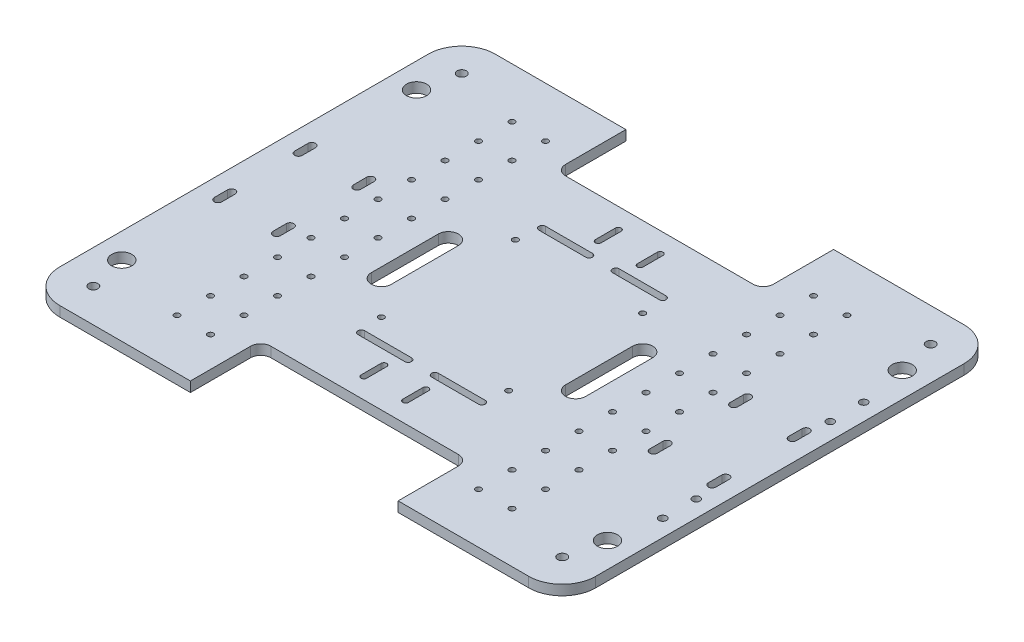
from build123d import *

# Parameters (mm, degrees)
PLATE_DEPTH                       = 6
CUT_MOTORMOUNTS_M3_DEPTH          = 207.242575624
CUT_MOTORMOUNTS_M3_DEPTH_BACK     = 207.242575624
CUT_CASTERMOUNTS_M4_DEPTH         = 207.242575624
CUT_CASTERMOUNTS_M4_DEPTH_BACK    = 207.242575624
CUT_BATTERYBAY_DEPTH              = 207.242575624
CUT_BATTERYBAY_DEPTH_BACK         = 207.242575624
SK_BATTERYBAY_R                   = 1.7
CUT_CABLEPASSTHRU_DEPTH           = 207.242575624
CUT_CABLEPASSTHRU_DEPTH_BACK      = 207.242575624
CUT_ELECGRID_M3_DEPTH             = 207.242575624
CUT_ELECGRID_M3_DEPTH_BACK        = 207.242575624
SK_ELECGRID_M3_R                  = 1.7
CUT_DECKPOSTS_M5_DEPTH            = 207.242575624
CUT_DECKPOSTS_M5_DEPTH_BACK       = 207.242575624
SK_DECKPOSTS_M5_R                 = 2.75
CUT_CLIFFSENSORWINDOWS_DEPTH      = 207.242575624
CUT_CLIFFSENSORWINDOWS_DEPTH_BACK = 207.242575624
SK_CLIFFSENSORS_R                 = 6
CUT_CHARGECONTACTS_M4_DEPTH       = 207.242575624
CUT_CHARGECONTACTS_M4_DEPTH_BACK  = 207.242575624
SK_CHARGECONTACTS_R               = 2.25


with BuildPart() as part:
    # SK_Plate → Plate (new body)
    with BuildSketch(Plane(origin=(0, 0, 0), x_dir=(1, 0, 0), z_dir=(0, 1, 0))):
        with BuildLine():
            Line((160, -110), (160, 110))
            ThreePointArc((160, 110), (154.142135624, 124.142135624), (140, 130))
            Line((140, 130), (62, 130))
            Line((62, 130), (62, 94))
            ThreePointArc((62, 94), (60.242640687, 89.757359313), (56, 88))
            Line((56, 88), (-56, 88))
            ThreePointArc((-56, 88), (-60.242640687, 89.757359313), (-62, 94))
            Line((-62, 94), (-62, 130))
            Line((-62, 130), (-140, 130))
            ThreePointArc((-140, 130), (-154.142135624, 124.142135624), (-160, 110))
            Line((-160, 110), (-160, -110))
            ThreePointArc((-160, -110), (-154.142135624, -124.142135624), (-140, -130))
            Line((-140, -130), (-62, -130))
            Line((-62, -130), (-62, -94))
            ThreePointArc((-62, -94), (-60.242640687, -89.757359313), (-56, -88))
            Line((-56, -88), (56, -88))
            ThreePointArc((56, -88), (60.242640687, -89.757359313), (62, -94))
            Line((62, -94), (62, -130))
            Line((62, -130), (140, -130))
            ThreePointArc((140, -130), (154.142135624, -124.142135624), (160, -110))
        make_face()
    extrude(amount=PLATE_DEPTH)

    # SK_MotorMounts → Cut_MotorMounts_M3 (cut, two sides: drawn at the far end of the back side and taken through both)
    with BuildSketch(Plane(origin=(0, 0, 0), x_dir=(1, 0, 0), z_dir=(0, 1, 0)).offset(-CUT_MOTORMOUNTS_M3_DEPTH_BACK)):
        with BuildLine():
            Line((-14.2, 64), (-14.2, 76))
            ThreePointArc((-14.2, 76), (-12.5, 77.7), (-10.8, 76))
            Line((-10.8, 76), (-10.8, 64))
            ThreePointArc((-10.8, 64), (-12.5, 62.3), (-14.2, 64))
        make_face()
        with BuildLine():
            Line((10.8, 64), (10.8, 76))
            ThreePointArc((10.8, 76), (12.5, 77.7), (14.2, 76))
            Line((14.2, 76), (14.2, 64))
            ThreePointArc((14.2, 64), (12.5, 62.3), (10.8, 64))
        make_face()
        with BuildLine():
            Line((-10.8, -64), (-10.8, -76))
            ThreePointArc((-10.8, -76), (-12.5, -77.7), (-14.2, -76))
            Line((-14.2, -76), (-14.2, -64))
            ThreePointArc((-14.2, -64), (-12.5, -62.3), (-10.8, -64))
        make_face()
        with BuildLine():
            Line((14.2, -64), (14.2, -76))
            ThreePointArc((14.2, -76), (12.5, -77.7), (10.8, -76))
            Line((10.8, -76), (10.8, -64))
            ThreePointArc((10.8, -64), (12.5, -62.3), (14.2, -64))
        make_face()
    extrude(amount=CUT_MOTORMOUNTS_M3_DEPTH + CUT_MOTORMOUNTS_M3_DEPTH_BACK, mode=Mode.SUBTRACT)

    # SK_CasterMounts → Cut_CasterMounts_M4 (cut, two sides: drawn at the far end of the back side and taken through both)
    with BuildSketch(Plane(origin=(0, 0, 0), x_dir=(1, 0, 0), z_dir=(0, 1, 0)).offset(-CUT_CASTERMOUNTS_M4_DEPTH_BACK)):
        with BuildLine():
            Line((110.25, 20), (110.25, 28))
            ThreePointArc((110.25, 28), (112.5, 30.25), (114.75, 28))
            Line((114.75, 28), (114.75, 20))
            ThreePointArc((114.75, 20), (112.5, 17.75), (110.25, 20))
        make_face()
        with BuildLine():
            Line((114.75, -20), (114.75, -28))
            ThreePointArc((114.75, -28), (112.5, -30.25), (110.25, -28))
            Line((110.25, -28), (110.25, -20))
            ThreePointArc((110.25, -20), (112.5, -17.75), (114.75, -20))
        make_face()
        with BuildLine():
            Line((145.25, 20), (145.25, 28))
            ThreePointArc((145.25, 28), (147.5, 30.25), (149.75, 28))
            Line((149.75, 28), (149.75, 20))
            ThreePointArc((149.75, 20), (147.5, 17.75), (145.25, 20))
        make_face()
        with BuildLine():
            Line((149.75, -20), (149.75, -28))
            ThreePointArc((149.75, -28), (147.5, -30.25), (145.25, -28))
            Line((145.25, -28), (145.25, -20))
            ThreePointArc((145.25, -20), (147.5, -17.75), (149.75, -20))
        make_face()
        with BuildLine():
            Line((-149.75, 20), (-149.75, 28))
            ThreePointArc((-149.75, 28), (-147.5, 30.25), (-145.25, 28))
            Line((-145.25, 28), (-145.25, 20))
            ThreePointArc((-145.25, 20), (-147.5, 17.75), (-149.75, 20))
        make_face()
        with BuildLine():
            Line((-145.25, -20), (-145.25, -28))
            ThreePointArc((-145.25, -28), (-147.5, -30.25), (-149.75, -28))
            Line((-149.75, -28), (-149.75, -20))
            ThreePointArc((-149.75, -20), (-147.5, -17.75), (-145.25, -20))
        make_face()
        with BuildLine():
            Line((-114.75, 20), (-114.75, 28))
            ThreePointArc((-114.75, 28), (-112.5, 30.25), (-110.25, 28))
            Line((-110.25, 28), (-110.25, 20))
            ThreePointArc((-110.25, 20), (-112.5, 17.75), (-114.75, 20))
        make_face()
        with BuildLine():
            Line((-110.25, -20), (-110.25, -28))
            ThreePointArc((-110.25, -28), (-112.5, -30.25), (-114.75, -28))
            Line((-114.75, -28), (-114.75, -20))
            ThreePointArc((-114.75, -20), (-112.5, -17.75), (-110.25, -20))
        make_face()
    extrude(amount=CUT_CASTERMOUNTS_M4_DEPTH + CUT_CASTERMOUNTS_M4_DEPTH_BACK, mode=Mode.SUBTRACT)

    # SK_BatteryBay → Cut_BatteryBay (cut, two sides: drawn at the far end of the back side and taken through both)
    with BuildSketch(Plane(origin=(0, 0, 0), x_dir=(1, 0, 0), z_dir=(0, 1, 0)).offset(-CUT_BATTERYBAY_DEPTH_BACK)):
        with Locations(Location((-38, 40, 0), (0, 0, 270))):
            Circle(SK_BATTERYBAY_R)
        with Locations(Location((-38, -40, 0), (0, 0, 270))):
            Circle(SK_BATTERYBAY_R)
        with Locations(Location((38, 40, 0), (0, 0, 270))):
            Circle(SK_BATTERYBAY_R)
        with Locations(Location((38, -40, 0), (0, 0, 270))):
            Circle(SK_BATTERYBAY_R)
        with BuildLine():
            Line((-36, 56), (-8, 56))
            ThreePointArc((-8, 56), (-6, 54), (-8, 52))
            Line((-8, 52), (-36, 52))
            ThreePointArc((-36, 52), (-38, 54), (-36, 56))
        make_face()
        with BuildLine():
            Line((-36, -52), (-8, -52))
            ThreePointArc((-8, -52), (-6, -54), (-8, -56))
            Line((-8, -56), (-36, -56))
            ThreePointArc((-36, -56), (-38, -54), (-36, -52))
        make_face()
        with BuildLine():
            Line((8, 56), (36, 56))
            ThreePointArc((36, 56), (38, 54), (36, 52))
            Line((36, 52), (8, 52))
            ThreePointArc((8, 52), (6, 54), (8, 56))
        make_face()
        with BuildLine():
            Line((8, -52), (36, -52))
            ThreePointArc((36, -52), (38, -54), (36, -56))
            Line((36, -56), (8, -56))
            ThreePointArc((8, -56), (6, -54), (8, -52))
        make_face()
    extrude(amount=CUT_BATTERYBAY_DEPTH + CUT_BATTERYBAY_DEPTH_BACK, mode=Mode.SUBTRACT)

    # SK_CablePassThru → Cut_CablePassThru (cut, two sides: drawn at the far end of the back side and taken through both)
    with BuildSketch(Plane(origin=(0, 0, 0), x_dir=(1, 0, 0), z_dir=(0, 1, 0)).offset(-CUT_CABLEPASSTHRU_DEPTH_BACK)):
        with BuildLine():
            Line((52, -20), (52, 20))
            ThreePointArc((52, 20), (58, 26), (64, 20))
            Line((64, 20), (64, -20))
            ThreePointArc((64, -20), (58, -26), (52, -20))
        make_face()
        with BuildLine():
            Line((-64, -20), (-64, 20))
            ThreePointArc((-64, 20), (-58, 26), (-52, 20))
            Line((-52, 20), (-52, -20))
            ThreePointArc((-52, -20), (-58, -26), (-64, -20))
        make_face()
    extrude(amount=CUT_CABLEPASSTHRU_DEPTH + CUT_CABLEPASSTHRU_DEPTH_BACK, mode=Mode.SUBTRACT)

    # SK_ElecGrid_M3 → Cut_ElecGrid_M3 (cut, two sides: drawn at the far end of the back side and taken through both)
    with BuildSketch(Plane(origin=(0, 0, 0), x_dir=(1, 0, 0), z_dir=(0, 1, 0)).offset(-CUT_ELECGRID_M3_DEPTH_BACK)):
        with Locations(Location((-100, -100, 0), (0, 0, 270))):
            Circle(SK_ELECGRID_M3_R)
        with Locations(Location((-100, -80, 0), (0, 0, 270))):
            Circle(SK_ELECGRID_M3_R)
        with Locations(Location((-100, -60, 0), (0, 0, 270))):
            Circle(SK_ELECGRID_M3_R)
        with Locations(Location((-100, -40, 0), (0, 0, 270))):
            Circle(SK_ELECGRID_M3_R)
        with Locations(Location((-100, -20, 0), (0, 0, 270))):
            Circle(SK_ELECGRID_M3_R)
        with Locations(Location((-100, 0, 0), (0, 0, 270))):
            Circle(SK_ELECGRID_M3_R)
        with Locations(Location((-100, 20, 0), (0, 0, 270))):
            Circle(SK_ELECGRID_M3_R)
        with Locations(Location((-100, 40, 0), (0, 0, 270))):
            Circle(SK_ELECGRID_M3_R)
        with Locations(Location((-100, 60, 0), (0, 0, 270))):
            Circle(SK_ELECGRID_M3_R)
        with Locations(Location((-100, 80, 0), (0, 0, 270))):
            Circle(SK_ELECGRID_M3_R)
        with Locations(Location((-100, 100, 0), (0, 0, 270))):
            Circle(SK_ELECGRID_M3_R)
        with Locations(Location((-80, -100, 0), (0, 0, 270))):
            Circle(SK_ELECGRID_M3_R)
        with Locations(Location((-80, -80, 0), (0, 0, 270))):
            Circle(SK_ELECGRID_M3_R)
        with Locations(Location((-80, -60, 0), (0, 0, 270))):
            Circle(SK_ELECGRID_M3_R)
        with Locations(Location((-80, -40, 0), (0, 0, 270))):
            Circle(SK_ELECGRID_M3_R)
        with Locations(Location((-80, -20, 0), (0, 0, 270))):
            Circle(SK_ELECGRID_M3_R)
        with Locations(Location((-80, 0, 0), (0, 0, 270))):
            Circle(SK_ELECGRID_M3_R)
        with Locations(Location((-80, 20, 0), (0, 0, 270))):
            Circle(SK_ELECGRID_M3_R)
        with Locations(Location((-80, 40, 0), (0, 0, 270))):
            Circle(SK_ELECGRID_M3_R)
        with Locations(Location((-80, 60, 0), (0, 0, 270))):
            Circle(SK_ELECGRID_M3_R)
        with Locations(Location((-80, 80, 0), (0, 0, 270))):
            Circle(SK_ELECGRID_M3_R)
        with Locations(Location((-80, 100, 0), (0, 0, 270))):
            Circle(SK_ELECGRID_M3_R)
        with Locations(Location((80, -100, 0), (0, 0, 270))):
            Circle(SK_ELECGRID_M3_R)
        with Locations(Location((80, -80, 0), (0, 0, 270))):
            Circle(SK_ELECGRID_M3_R)
        with Locations(Location((80, -60, 0), (0, 0, 270))):
            Circle(SK_ELECGRID_M3_R)
        with Locations(Location((80, -40, 0), (0, 0, 270))):
            Circle(SK_ELECGRID_M3_R)
        with Locations(Location((80, -20, 0), (0, 0, 270))):
            Circle(SK_ELECGRID_M3_R)
        with Locations(Location((80, 0, 0), (0, 0, 270))):
            Circle(SK_ELECGRID_M3_R)
        with Locations(Location((80, 20, 0), (0, 0, 270))):
            Circle(SK_ELECGRID_M3_R)
        with Locations(Location((80, 40, 0), (0, 0, 270))):
            Circle(SK_ELECGRID_M3_R)
        with Locations(Location((80, 60, 0), (0, 0, 270))):
            Circle(SK_ELECGRID_M3_R)
        with Locations(Location((80, 80, 0), (0, 0, 270))):
            Circle(SK_ELECGRID_M3_R)
        with Locations(Location((80, 100, 0), (0, 0, 270))):
            Circle(SK_ELECGRID_M3_R)
        with Locations(Location((100, -100, 0), (0, 0, 270))):
            Circle(SK_ELECGRID_M3_R)
        with Locations(Location((100, -80, 0), (0, 0, 270))):
            Circle(SK_ELECGRID_M3_R)
        with Locations(Location((100, -60, 0), (0, 0, 270))):
            Circle(SK_ELECGRID_M3_R)
        with Locations(Location((100, -40, 0), (0, 0, 270))):
            Circle(SK_ELECGRID_M3_R)
        with Locations(Location((100, -20, 0), (0, 0, 270))):
            Circle(SK_ELECGRID_M3_R)
        with Locations(Location((100, 0, 0), (0, 0, 270))):
            Circle(SK_ELECGRID_M3_R)
        with Locations(Location((100, 20, 0), (0, 0, 270))):
            Circle(SK_ELECGRID_M3_R)
        with Locations(Location((100, 40, 0), (0, 0, 270))):
            Circle(SK_ELECGRID_M3_R)
        with Locations(Location((100, 60, 0), (0, 0, 270))):
            Circle(SK_ELECGRID_M3_R)
        with Locations(Location((100, 80, 0), (0, 0, 270))):
            Circle(SK_ELECGRID_M3_R)
        with Locations(Location((100, 100, 0), (0, 0, 270))):
            Circle(SK_ELECGRID_M3_R)
    extrude(amount=CUT_ELECGRID_M3_DEPTH + CUT_ELECGRID_M3_DEPTH_BACK, mode=Mode.SUBTRACT)

    # SK_DeckPosts_M5 → Cut_DeckPosts_M5 (cut, two sides: drawn at the far end of the back side and taken through both)
    with BuildSketch(Plane(origin=(0, 0, 0), x_dir=(1, 0, 0), z_dir=(0, 1, 0)).offset(-CUT_DECKPOSTS_M5_DEPTH_BACK)):
        with Locations(Location((140, 110, 0), (0, 0, 270))):
            Circle(SK_DECKPOSTS_M5_R)
        with Locations(Location((140, -110, 0), (0, 0, 270))):
            Circle(SK_DECKPOSTS_M5_R)
        with Locations(Location((-140, 110, 0), (0, 0, 270))):
            Circle(SK_DECKPOSTS_M5_R)
        with Locations(Location((-140, -110, 0), (0, 0, 270))):
            Circle(SK_DECKPOSTS_M5_R)
    extrude(amount=CUT_DECKPOSTS_M5_DEPTH + CUT_DECKPOSTS_M5_DEPTH_BACK, mode=Mode.SUBTRACT)

    # SK_CliffSensors → Cut_CliffSensorWindows (cut, two sides: drawn at the far end of the back side and taken through both)
    with BuildSketch(Plane(origin=(0, 0, 0), x_dir=(1, 0, 0), z_dir=(0, 1, 0)).offset(-CUT_CLIFFSENSORWINDOWS_DEPTH_BACK)):
        with Locations(Location((145, 88, 0), (0, 0, 270))):
            Circle(SK_CLIFFSENSORS_R)
        with Locations(Location((145, -88, 0), (0, 0, 270))):
            Circle(SK_CLIFFSENSORS_R)
        with Locations(Location((-145, 88, 0), (0, 0, 270))):
            Circle(SK_CLIFFSENSORS_R)
        with Locations(Location((-145, -88, 0), (0, 0, 270))):
            Circle(SK_CLIFFSENSORS_R)
    extrude(amount=CUT_CLIFFSENSORWINDOWS_DEPTH + CUT_CLIFFSENSORWINDOWS_DEPTH_BACK, mode=Mode.SUBTRACT)

    # SK_ChargeContacts → Cut_ChargeContacts_M4 (cut, two sides: drawn at the far end of the back side and taken through both)
    with BuildSketch(Plane(origin=(0, 0, 0), x_dir=(1, 0, 0), z_dir=(0, 1, 0)).offset(-CUT_CHARGECONTACTS_M4_DEPTH_BACK)):
        with Locations(Location((150, 40, 0), (0, 0, 270))):
            Circle(SK_CHARGECONTACTS_R)
        with Locations(Location((150, 60, 0), (0, 0, 270))):
            Circle(SK_CHARGECONTACTS_R)
        with Locations(Location((150, -40, 0), (0, 0, 270))):
            Circle(SK_CHARGECONTACTS_R)
        with Locations(Location((150, -60, 0), (0, 0, 270))):
            Circle(SK_CHARGECONTACTS_R)
    extrude(amount=CUT_CHARGECONTACTS_M4_DEPTH + CUT_CHARGECONTACTS_M4_DEPTH_BACK, mode=Mode.SUBTRACT)


solid = part.part
